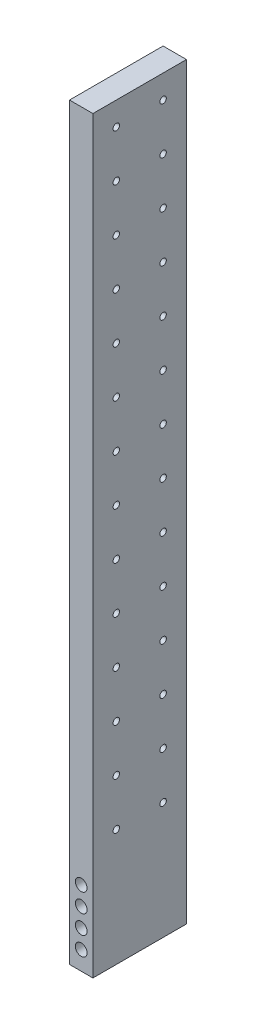
from build123d import *

# Parameters (mm, degrees)
SKETCH1_W                                   = 12.7
SKETCH1_H                                   = 406.4
BOSS_EXTRUDE1_DEPTH                         = 25.4
F_10_32_THREADED_HOLES_D                    = 3.51028
CBORE_FOR_10_HEX_MACHINE_SCREW1_D           = 6.35
CBORE_FOR_10_HEX_MACHINE_SCREW1_CBORE_D     = 9.525
CBORE_FOR_10_HEX_MACHINE_SCREW1_CBORE_DEPTH = 12.7


with BuildPart() as part:
    # Sketch1 → Boss-Extrude1 (new, symmetric)
    with BuildSketch(Plane.XY):
        with Locations((6.35, -203.2)):
            Rectangle(SKETCH1_W, SKETCH1_H)
    extrude(amount=BOSS_EXTRUDE1_DEPTH, both=True)

    # #10-32 Threaded Holes (through all)
    with Locations(Plane(origin=(12.7, 0, 0), x_dir=(0, 0, -1), z_dir=(1, 0, 0))):
        with Locations((-12.7, -12.7), (12.7, -12.7), (-12.7, -38.1), (12.7, -38.1), (-12.7, -63.5), (12.7, -63.5), (-12.7, -88.9), (12.7, -88.9), (-12.7, -114.3), (12.7, -114.3), (-12.7, -139.7), (12.7, -139.7), (-12.7, -165.1), (12.7, -165.1), (-12.7, -190.5), (12.7, -190.5), (-12.7, -215.9), (12.7, -215.9), (-12.7, -241.3), (12.7, -241.3), (-12.7, -266.7), (12.7, -266.7), (-12.7, -292.1), (12.7, -292.1), (-12.7, -317.5), (12.7, -317.5), (-12.7, -342.9), (12.7, -342.9)):
            Hole(F_10_32_THREADED_HOLES_D / 2)

    # CBORE for #10 Hex Machine Screw1 (through all)
    with Locations(Plane(origin=(0, 0, -25.4), x_dir=(-1, 0, 0), z_dir=(0, 0, -1))):
        with Locations((-6.35, -396.24), (-6.35, -386.08), (-6.35, -375.92), (-6.35, -365.76)):
            CounterBoreHole(CBORE_FOR_10_HEX_MACHINE_SCREW1_D / 2, CBORE_FOR_10_HEX_MACHINE_SCREW1_CBORE_D / 2, CBORE_FOR_10_HEX_MACHINE_SCREW1_CBORE_DEPTH)


solid = part.part
